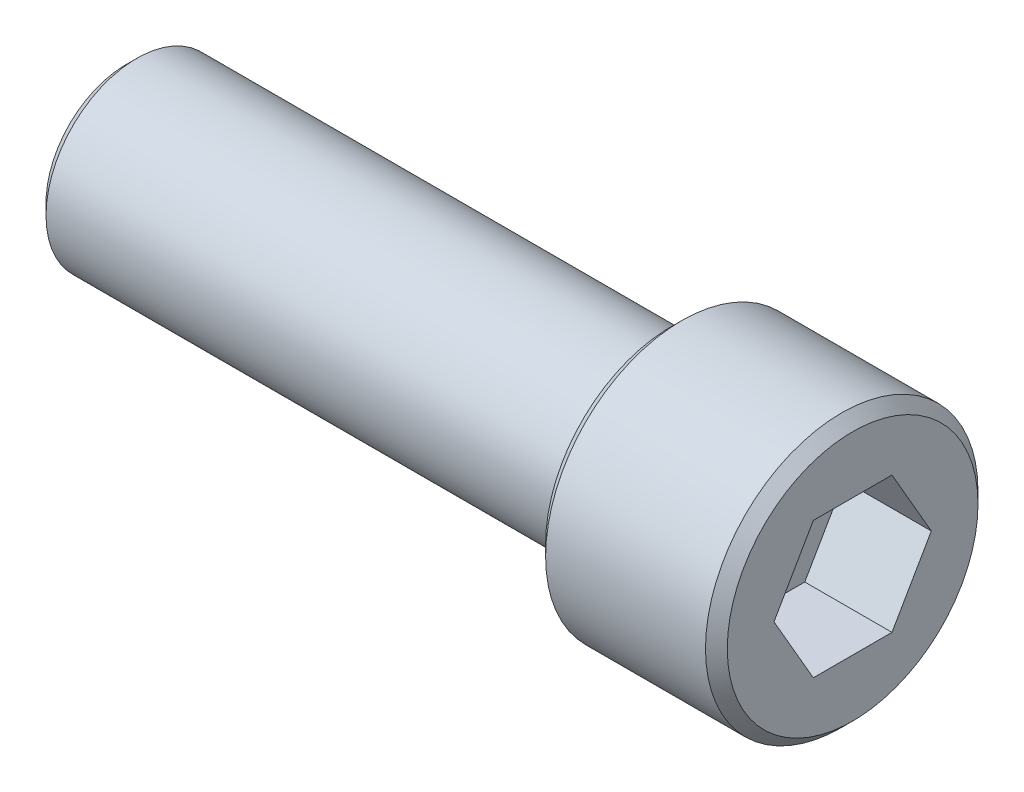
from build123d import *

# Parameters (mm, degrees)
HEX_CUT_DEPTH = 3.048
CHAMFER2_SIZE = 0.381


with BuildPart() as part:
    # Base Sketch → Base (revolve)
    with BuildSketch(Plane.XY, mode=Mode.PRIVATE) as base_sk:
        Polygon((0, 0), (25.4, 0), (25.4, 4.7625), (19.05, 4.7625), (19.05, 3.175), (0, 3.175), align=None)
    revolve(base_sk.sketch.rotate(Axis((0, 0, 0), (1, 0, 0)), 90), axis=Axis((0, 0, 0), (1, 0, 0)))

    # Hex Sketch → Hex Cut (cut)
    with BuildSketch(Plane(origin=(25.4, 0, 0), x_dir=(0, 0, -1), z_dir=(1, 0, 0))):
        Polygon((-1.374815329, 2.38125), (-2.749630657, 0), (-1.374815329, -2.38125), (1.374815329, -2.38125), (2.749630657, 0), (1.374815329, 2.38125), align=None)
    extrude(amount=-HEX_CUT_DEPTH, mode=Mode.SUBTRACT)

    # Chamfer2
    chamfer2_edges = [part.edges().sort_by_distance(p)[0] for p in [
        (0, 0, -3.175),
        (19.05, 0, -4.7625),
        (25.4, 0, -4.7625),
    ]]
    chamfer(chamfer2_edges, length=CHAMFER2_SIZE)


solid = part.part
